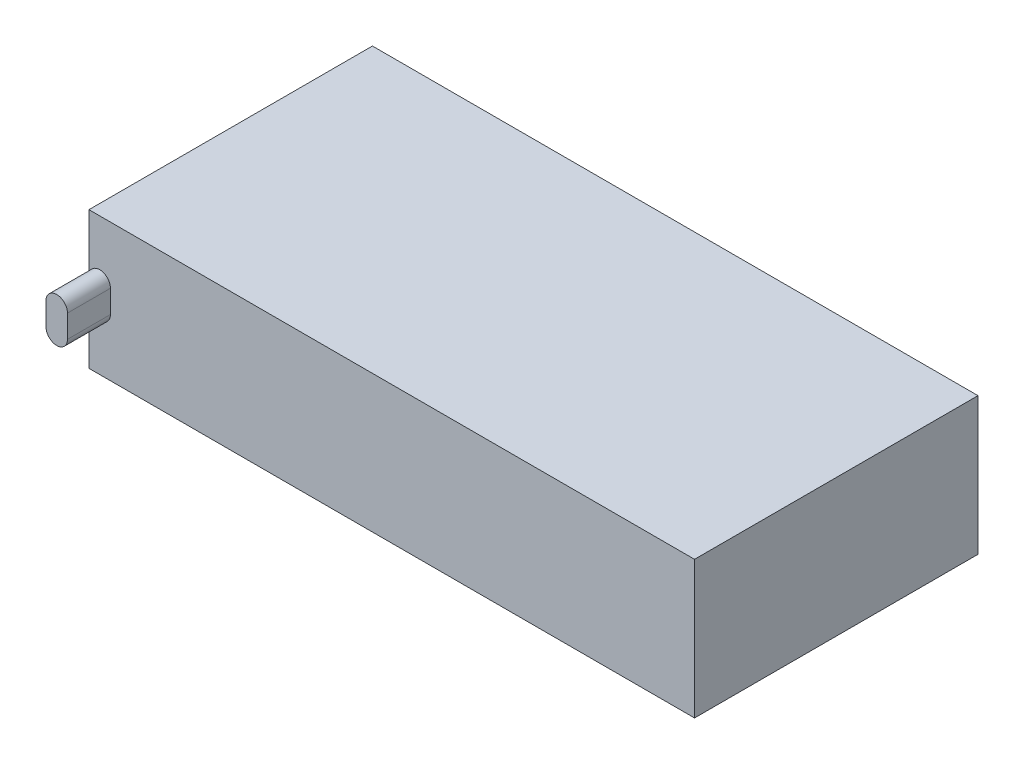
from build123d import *

# Parameters (mm, degrees)
SKETCH1_W           = 16.764
SKETCH1_H           = 8.128
BOSS_EXTRUDE1_DEPTH = 35.814
BOSS_EXTRUDE2_DEPTH = 2.54


with BuildPart() as part:
    # Sketch1 → Boss-Extrude1 (new body)
    with BuildSketch(Plane(origin=(0, 0, 0), x_dir=(0, 0, -1), z_dir=(1, 0, 0))):
        with Locations((8.382, 4.064)):
            Rectangle(SKETCH1_W, SKETCH1_H)
    extrude(amount=BOSS_EXTRUDE1_DEPTH)

    # Sketch2 → Boss-Extrude2 (add)
    with BuildSketch(Plane.XY):
        with BuildLine():
            Line((1.27, 4.736473545), (1.27, 3.391526455))
            ThreePointArc((1.27, 3.391526455), (0.635, 2.756526455), (0, 3.391526455))
            Line((0, 3.391526455), (0, 4.736473545))
            ThreePointArc((0, 4.736473545), (0.635, 5.371473545), (1.27, 4.736473545))
        make_face()
    extrude(amount=BOSS_EXTRUDE2_DEPTH)


solid = part.part
